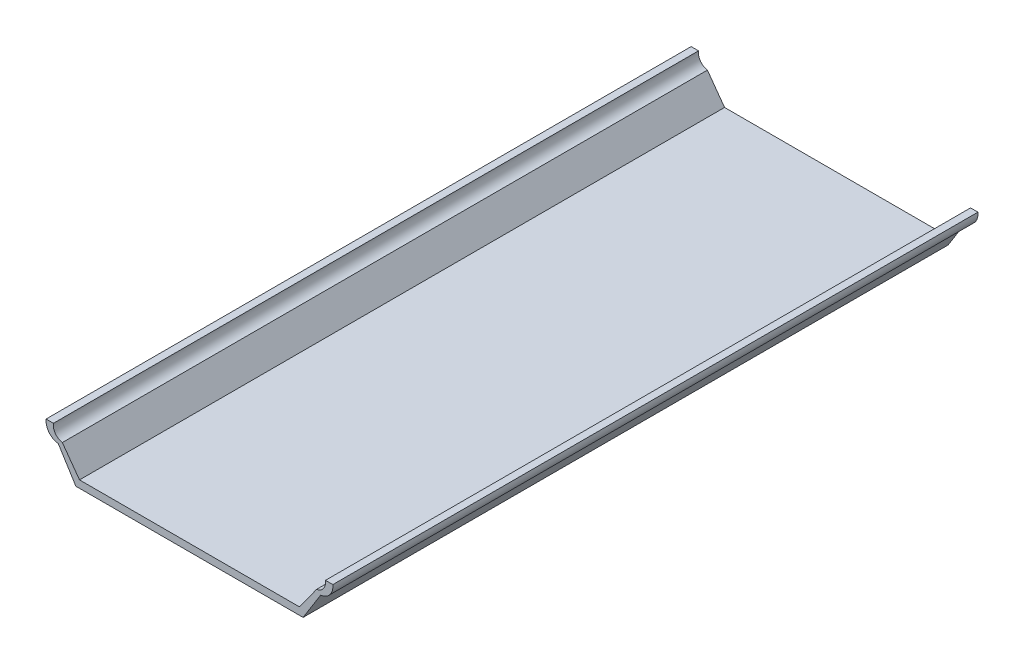
from build123d import *

# Parameters (mm, degrees)
BOSS_EXTRU_1_DEPTH = 88


with BuildPart() as part:
    # Esquisse1 → Boss.-Extru.1 (new body)
    with BuildSketch(Plane.XY):
        with BuildLine():
            Line((-15, 0), (15, 0))
            Line((15, 0), (17.344945782, 3.240560025))
            ThreePointArc((17.344945782, 3.240560025), (18.296188165, 3.825988261), (18.554857829, 4.912578476))
            Line((18.554857829, 4.912578476), (19.560072663, 4.912578476))
            ThreePointArc((19.560072663, 4.912578476), (19.160107786, 3.5317888), (17.900924166, 2.838240933))
            Line((17.900924166, 2.838240933), (15.5, -1))
            Line((15.5, -1), (-15.5, -1))
            Line((-15.5, -1), (-17.900924166, 2.838240933))
            ThreePointArc((-17.900924166, 2.838240933), (-19.160107786, 3.5317888), (-19.560072663, 4.912578476))
            Line((-19.560072663, 4.912578476), (-18.554857829, 4.912578476))
            ThreePointArc((-18.554857829, 4.912578476), (-18.296188165, 3.825988261), (-17.344945782, 3.240560025))
            Line((-17.344945782, 3.240560025), (-15, 0))
        make_face()
    extrude(amount=BOSS_EXTRU_1_DEPTH)


solid = part.part
